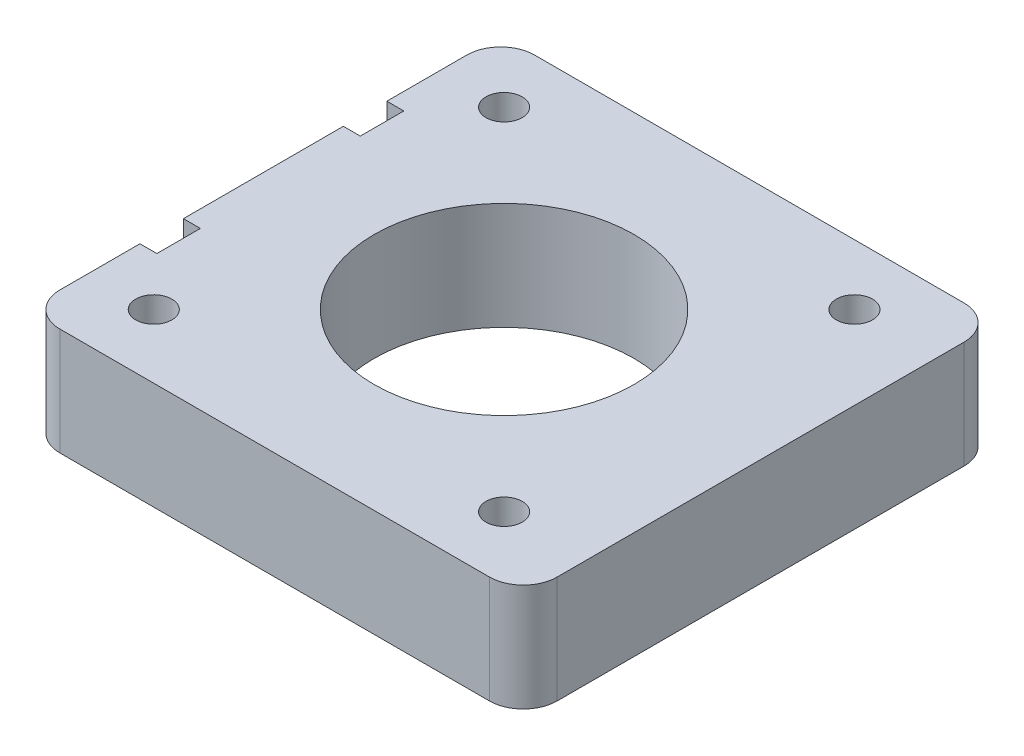
from build123d import *

# Parameters (mm, degrees)
SKETCH_1_W          = 44
SKETCH_1_H          = 42
EXTRUDE_1_DEPTH     = 9.5
SKETCH_2_R          = 11.5
CUT_EXTRUDE_1_DEPTH = 62.565006294
FILLET_1_R          = 3
SKETCH_5_R          = 1.6
CUT_EXTRUDE_2_DEPTH = 62.565006294
SKETCH_8_W          = 3.85
SKETCH_8_H          = 9.5
CUT_EXTRUDE_3_DEPTH = 1.5


with BuildPart() as part:
    # 草图1 → 凸台-拉伸1 (new body)
    with BuildSketch(Plane(origin=(0, 0, 0), x_dir=(1, 0, 0), z_dir=(0, 1, 0))):
        with Locations((22, -21)):
            Rectangle(SKETCH_1_W, SKETCH_1_H)
    extrude(amount=EXTRUDE_1_DEPTH)

    # 草图2 → 切除-拉伸1 (cut, through all)
    with BuildSketch(Plane(origin=(0, 9.5, 0), x_dir=(1, 0, 0), z_dir=(0, 1, 0))):
        with Locations(Location((21.15, -20.85, 0), (0, 0, 270))):
            Circle(SKETCH_2_R)
    extrude(amount=-CUT_EXTRUDE_1_DEPTH, mode=Mode.SUBTRACT)

    # 圆角1
    fillet_1_edges = [part.edges().sort_by_distance(p)[0] for p in [
        (0, 4.75, 0),
        (44, 4.75, 0),
        (44, 4.75, 42),
        (0, 4.75, 42),
    ]]
    fillet(fillet_1_edges, radius=FILLET_1_R)

    # 草图5 → 切除-拉伸2 (cut, through all)
    with BuildSketch(Plane.XZ):
        with Locations(Location((36.65, 36.35, 0), (0, 0, 270))):
            Circle(SKETCH_5_R)
        with Locations(Location((5.65, 36.35, 0), (0, 0, 270))):
            Circle(SKETCH_5_R)
        with Locations(Location((5.65, 5.35, 0), (0, 0, 270))):
            Circle(SKETCH_5_R)
        with Locations(Location((36.65, 5.35, 0), (0, 0, 270))):
            Circle(SKETCH_5_R)
    extrude(amount=-CUT_EXTRUDE_2_DEPTH, mode=Mode.SUBTRACT)

    # 草图8 → 切除-拉伸3 (cut)
    with BuildSketch(Plane.ZY):
        with Locations((12, 4.75)):
            Rectangle(SKETCH_8_W, SKETCH_8_H)
        with Locations((30, 4.75)):
            Rectangle(SKETCH_8_W, SKETCH_8_H)
    extrude(amount=-CUT_EXTRUDE_3_DEPTH, mode=Mode.SUBTRACT)


solid = part.part
